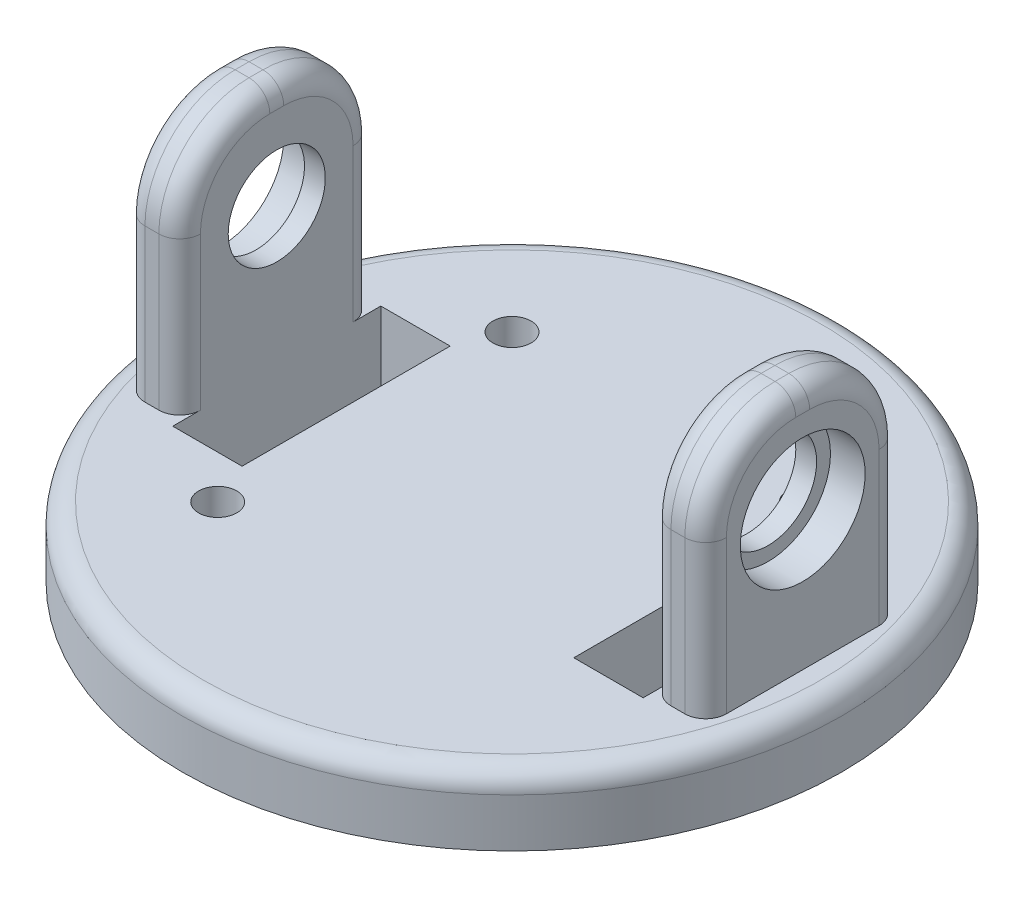
from build123d import *

# Parameters (mm, degrees)
SKETCH1_R           = 47.5
BOSS_EXTRUDE1_DEPTH = 10
SKETCH2_W           = 8
SKETCH2_H           = 28
BOSS_EXTRUDE2_DEPTH = 35
SKETCH3_R           = 2.75
CUT_EXTRUDE1_DEPTH  = 70
SKETCH4_R           = 9
CUT_EXTRUDE2_DEPTH  = 5
CUT_EXTRUDE3_START  = -5
SKETCH5_R           = 9
CUT_EXTRUDE3_DEPTH  = 5
SKETCH6_R           = 7
CUT_EXTRUDE4_DEPTH  = 107.800272003
FILLET1_R           = 13
FILLET2_R           = 3
FILLET3_R           = 3
SKETCH7_W           = 10
SKETCH7_H           = 30
CUT_EXTRUDE5_DEPTH  = 76.7462871


with BuildPart() as part:
    # Sketch1 → Boss-Extrude1 (new body)
    with BuildSketch(Plane(origin=(0, 0, 0), x_dir=(1, 0, 0), z_dir=(0, 1, 0))):
        with Locations(Location((0, 0, 0), (0, 0, 270))):
            Circle(SKETCH1_R)
    extrude(amount=BOSS_EXTRUDE1_DEPTH)

    # Sketch2 → Boss-Extrude2 (add)
    with BuildSketch(Plane(origin=(0, 10, 0), x_dir=(1, 0, 0), z_dir=(0, 1, 0))):
        with Locations((-37.91, 0)):
            Rectangle(SKETCH2_W, SKETCH2_H)
        with Locations((37.91, 0)):
            Rectangle(SKETCH2_W, SKETCH2_H)
    extrude(amount=BOSS_EXTRUDE2_DEPTH)

    # Sketch3 → Cut-Extrude1 (cut)
    with BuildSketch(Plane(origin=(0, 10, 0), x_dir=(1, 0, 0), z_dir=(0, 1, 0))):
        with Locations(Location((-21.213203436, 21.213203436, 0), (0, 0, 270))):
            Circle(SKETCH3_R)
        with Locations(Location((21.213203436, 21.213203436, 0), (0, 0, 270))):
            Circle(SKETCH3_R)
        with Locations(Location((-21.213203436, -21.213203436, 0), (0, 0, 270))):
            Circle(SKETCH3_R)
    extrude(amount=-CUT_EXTRUDE1_DEPTH, mode=Mode.SUBTRACT)

    # Sketch4 → Cut-Extrude2 (cut)
    with BuildSketch(Plane.ZY.offset(41.91)):
        with Locations((0, 30)):
            Circle(SKETCH4_R)
    extrude(amount=-CUT_EXTRUDE2_DEPTH, mode=Mode.SUBTRACT)

    # Sketch5 → Cut-Extrude3 (cut)
    with BuildSketch(Plane(origin=(41.91, 0, 0), x_dir=(0, 0, -1), z_dir=(1, 0, 0)).offset(CUT_EXTRUDE3_START)):
        with Locations(Location((0, 30, 0), (0, 0, 180))):
            Circle(SKETCH5_R)
    extrude(amount=CUT_EXTRUDE3_DEPTH, mode=Mode.SUBTRACT)

    # Sketch6 → Cut-Extrude4 (cut, through all)
    with BuildSketch(Plane.ZY.offset(36.91)):
        with Locations(Location((0, 30, 0), (0, 0, 180))):
            Circle(SKETCH6_R)
    extrude(amount=-CUT_EXTRUDE4_DEPTH, mode=Mode.SUBTRACT)

    # Fillet1
    fillet1_edges = [part.edges().sort_by_distance(p)[0] for p in [
        (-37.91, 45, -14),
        (37.91, 45, -14),
        (37.91, 45, 14),
        (-37.91, 45, 14),
    ]]
    fillet(fillet1_edges, radius=FILLET1_R)

    # Fillet2
    fillet2_edges = [part.edges().sort_by_distance(p)[0] for p in [
        (33.91, 45, 0),
        (41.91, 45, 0),
        (41.91, 21, -14),
        (41.91, 21, 14),
        (41.91, 41.192388155, -10.192388155),
        (41.91, 41.192388155, 10.192388155),
        (33.91, 21, 14),
        (33.91, 21, -14),
        (33.91, 41.192388155, -10.192388155),
        (33.91, 41.192388155, 10.192388155),
        (-41.91, 45, 0),
        (-33.91, 45, 0),
        (-41.91, 21, 14),
        (-41.91, 21, -14),
        (-41.91, 41.192388155, 10.192388155),
        (-41.91, 41.192388155, -10.192388155),
        (-33.91, 21, -14),
        (-33.91, 21, 14),
        (-33.91, 41.192388155, 10.192388155),
        (-33.91, 41.192388155, -10.192388155),
    ]]
    fillet(fillet2_edges, radius=FILLET2_R)

    # Fillet3
    fillet3_edges = [part.edges().sort_by_distance(p)[0] for p in [
        (0, 10, -47.5),
    ]]
    fillet(fillet3_edges, radius=FILLET3_R)

    # Sketch7 → Cut-Extrude5 (cut, through all)
    with BuildSketch(Plane(origin=(0, 10, 0), x_dir=(1, 0, 0), z_dir=(0, 1, 0))):
        with Locations((-28.91, 0)):
            Rectangle(SKETCH7_W, SKETCH7_H)
        with Locations((28.91, 0)):
            Rectangle(SKETCH7_W, SKETCH7_H)
    extrude(amount=-CUT_EXTRUDE5_DEPTH, mode=Mode.SUBTRACT)


solid = part.part
